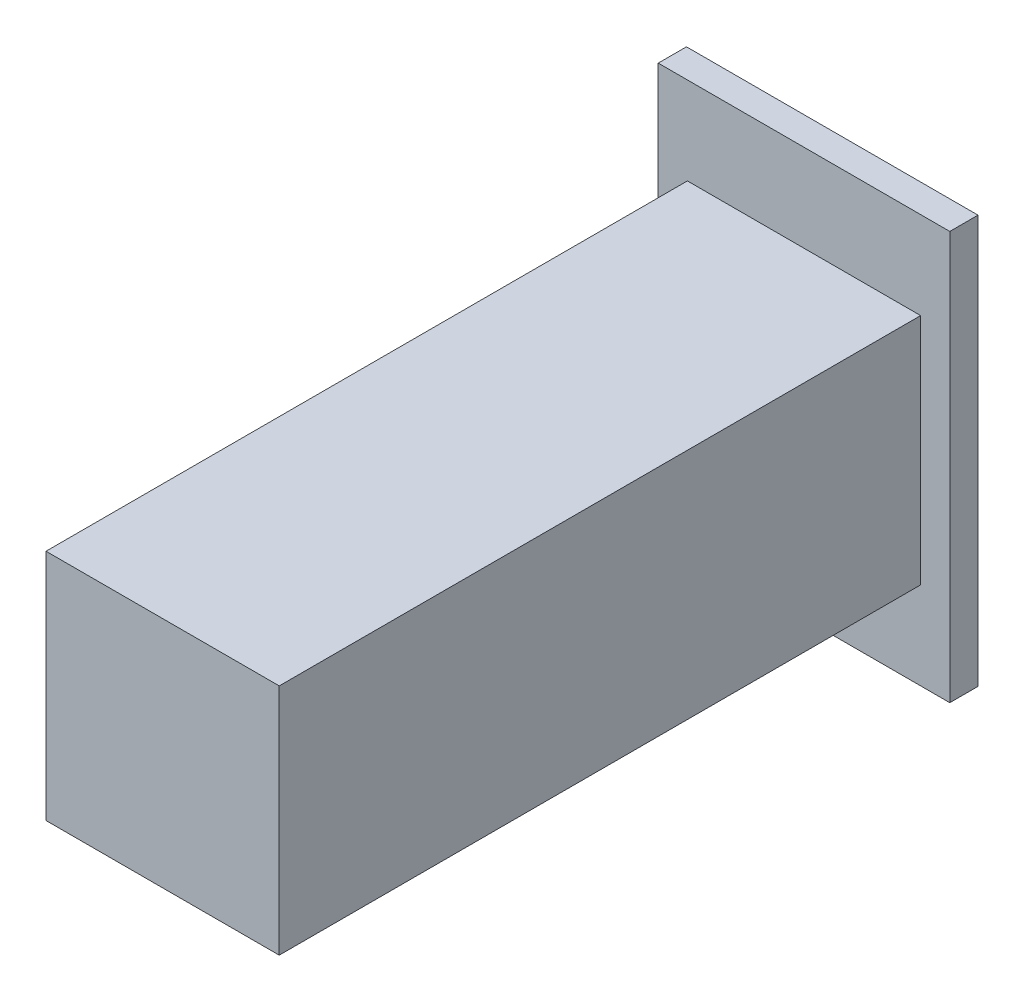
from build123d import *

# Parameters (mm, degrees)
SKETCH1_W           = 25
SKETCH1_H           = 35
SKETCH1_W_2         = 20
SKETCH1_H_2         = 20
BOSS_EXTRUDE1_DEPTH = 2.42
SKETCH1_2_W         = 20
SKETCH1_2_H         = 20
BOSS_EXTRUDE2_DEPTH = 57.42


with BuildPart() as part:
    # Sketch1 → Boss-Extrude1 (new body)
    with BuildSketch(Plane.XY):
        Rectangle(SKETCH1_W, SKETCH1_H)
        Rectangle(SKETCH1_W_2, SKETCH1_H_2, mode=Mode.SUBTRACT)
    extrude(amount=BOSS_EXTRUDE1_DEPTH)

    # Sketch1<2> → Boss-Extrude2 (add)
    with BuildSketch(Plane.XY):
        Rectangle(SKETCH1_2_W, SKETCH1_2_H)
    extrude(amount=BOSS_EXTRUDE2_DEPTH)


solid = part.part
